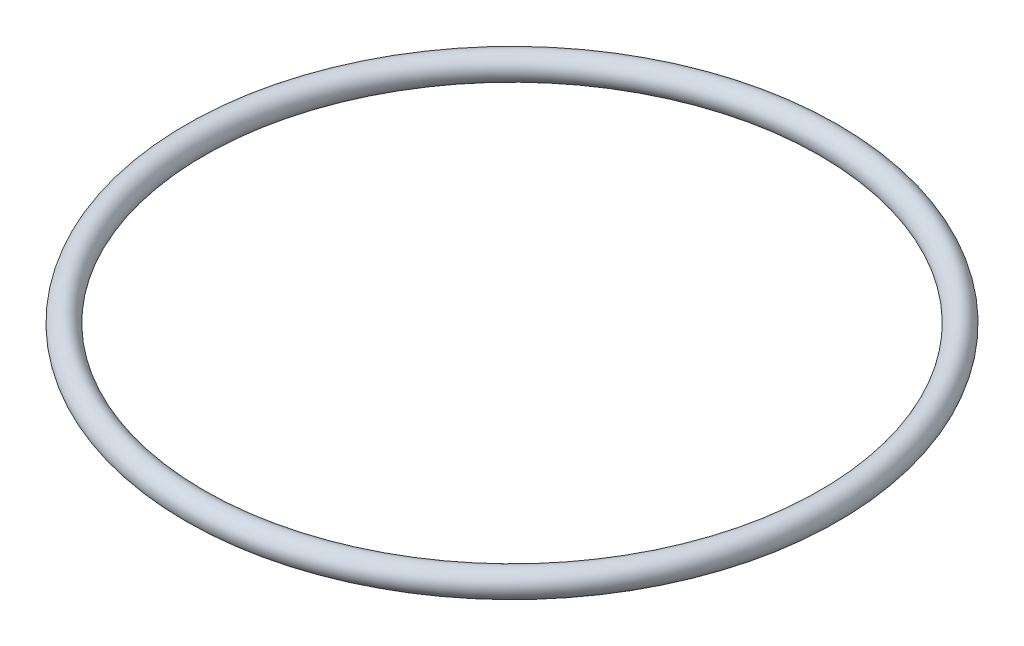
from build123d import *

# Parameters (mm, degrees)
SKETCH2_R = 0.79375


with BuildPart() as part:
    # Sketch2 → Revolve1 (revolve)
    with BuildSketch(Plane.XY, mode=Mode.PRIVATE) as revolve1_sk:
        with Locations((-19.84375, 0)):
            Circle(SKETCH2_R)
    revolve(revolve1_sk.sketch.rotate(Axis((0, -25.636498532, 0), (0, 1, 0)), 270), axis=Axis((0, -25.636498532, 0), (0, 1, 0)))


solid = part.part
